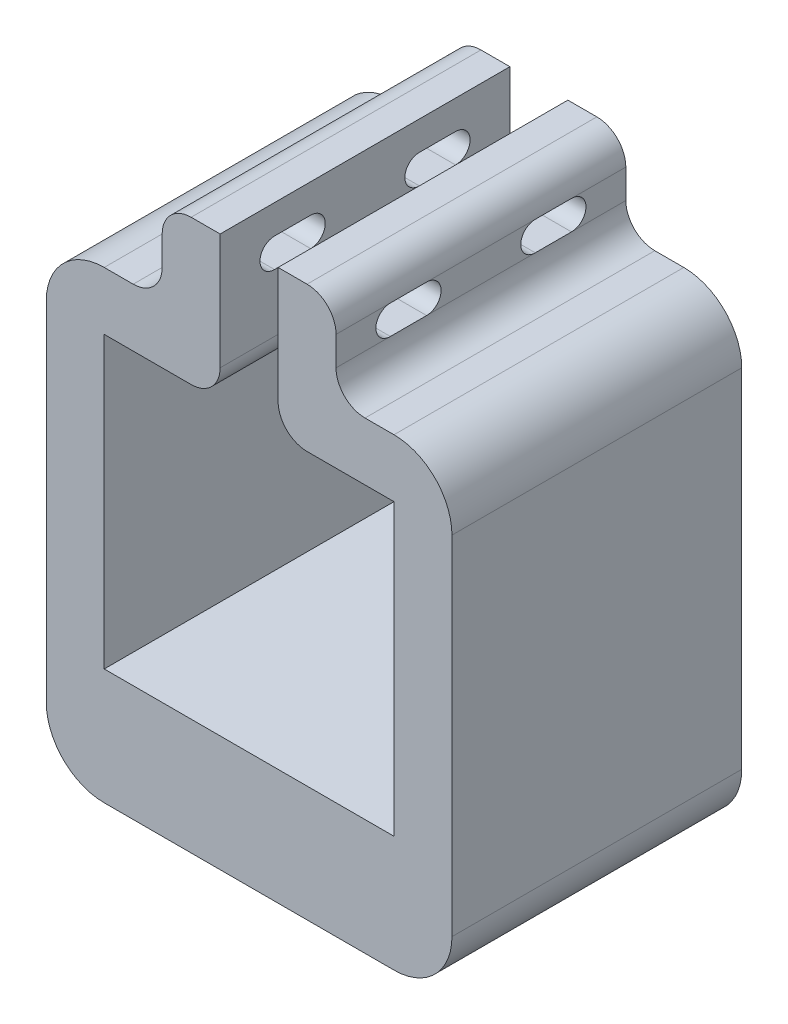
from build123d import *

# Parameters (mm, degrees)
SKETCH1_W                = 25.4
SKETCH1_H                = 25.4
BOSS_EXTRUDE1_DEPTH      = 25.4
SKETCH2_W                = 5.08
SKETCH2_H                = 5.08
CUT_EXTRUDE1_DEPTH       = 51.032197633
FILLET1_R                = 2.54
SKETCH3_W                = 5.08
SKETCH3_H                = 7.62
BOSS_EXTRUDE2_DEPTH      = 25.4
FILLET2_R                = 2.54
CUT_EXTRUDE2_DEPTH       = 53.363441445
BOSS_EXTRUDE3_DEPTH      = 5.08
BOSS_EXTRUDE3_DEPTH_BACK = 5.08
SKETCH5_W                = 35.56
SKETCH5_H                = 25.4
FILLET3_R                = 5.08


with BuildPart() as part:
    # Sketch1 → Boss-Extrude1 (new body)
    with BuildSketch(Plane.XY):
        with BuildLine():
            Line((-5.08, 0), (-5.08, 25.4))
            ThreePointArc((-5.08, 25.4), (-3.592102448, 28.992102448), (0, 30.48))
            Line((0, 30.48), (25.4, 30.48))
            ThreePointArc((25.4, 30.48), (28.992102448, 28.992102448), (30.48, 25.4))
            Line((30.48, 25.4), (30.48, 0))
            ThreePointArc((30.48, 0), (28.992102448, -3.592102448), (25.4, -5.08))
            Line((25.4, -5.08), (0, -5.08))
            ThreePointArc((0, -5.08), (-3.592102448, -3.592102448), (-5.08, 0))
        make_face()
        with Locations((12.7, 12.7)):
            Rectangle(SKETCH1_W, SKETCH1_H, mode=Mode.SUBTRACT)
    extrude(amount=BOSS_EXTRUDE1_DEPTH)

    # Sketch2 → Cut-Extrude1 (cut, through all)
    with BuildSketch(Plane.XY.offset(25.4)):
        with Locations((12.7, 27.94)):
            Rectangle(SKETCH2_W, SKETCH2_H)
    extrude(amount=-CUT_EXTRUDE1_DEPTH, mode=Mode.SUBTRACT)

    # Fillet1
    fillet1_edges = [part.edges().sort_by_distance(p)[0] for p in [
        (10.16, 25.4, 12.7),
        (15.24, 25.4, 12.7),
    ]]
    fillet(fillet1_edges, radius=FILLET1_R)

    # Sketch3 → Boss-Extrude2 (add)
    with BuildSketch(Plane.XY.offset(25.4)):
        with Locations((7.62, 34.29)):
            Rectangle(SKETCH3_W, SKETCH3_H)
        with Locations((17.78, 34.29)):
            Rectangle(SKETCH3_W, SKETCH3_H)
    extrude(amount=-BOSS_EXTRUDE2_DEPTH)

    # Fillet2
    fillet2_edges = [part.edges().sort_by_distance(p)[0] for p in [
        (5.08, 30.48, 12.7),
        (5.08, 38.1, 12.7),
        (20.32, 38.1, 12.7),
        (20.32, 30.48, 12.7),
    ]]
    fillet(fillet2_edges, radius=FILLET2_R)

    # Sketch4 → Cut-Extrude2 (cut, through all)
    with BuildSketch(Plane.ZY.offset(-5.08)):
        with BuildLine():
            Line((4.7625, 35.56), (7.9375, 35.56))
            ThreePointArc((7.9375, 35.56), (9.2075, 34.29), (7.9375, 33.02))
            Line((7.9375, 33.02), (4.7625, 33.02))
            ThreePointArc((4.7625, 33.02), (3.4925, 34.29), (4.7625, 35.56))
        make_face()
        with BuildLine():
            Line((17.4625, 35.56), (20.6375, 35.56))
            ThreePointArc((20.6375, 35.56), (21.9075, 34.29), (20.6375, 33.02))
            Line((20.6375, 33.02), (17.4625, 33.02))
            ThreePointArc((17.4625, 33.02), (16.1925, 34.29), (17.4625, 35.56))
        make_face()
    extrude(amount=-CUT_EXTRUDE2_DEPTH, mode=Mode.SUBTRACT)

    # Sketch5 → Boss-Extrude3 (add, two sides: drawn at the far end of the back side and taken through both)
    with BuildSketch(Plane.XZ.offset(5.08).offset(-BOSS_EXTRUDE3_DEPTH_BACK)):
        with Locations((12.7, 12.7)):
            Rectangle(SKETCH5_W, SKETCH5_H)
    extrude(amount=BOSS_EXTRUDE3_DEPTH + BOSS_EXTRUDE3_DEPTH_BACK)

    # Fillet3
    fillet3_edges = [part.edges().sort_by_distance(p)[0] for p in [
        (-5.08, -10.16, 12.7),
        (30.48, -10.16, 12.7),
    ]]
    fillet(fillet3_edges, radius=FILLET3_R)


solid = part.part
